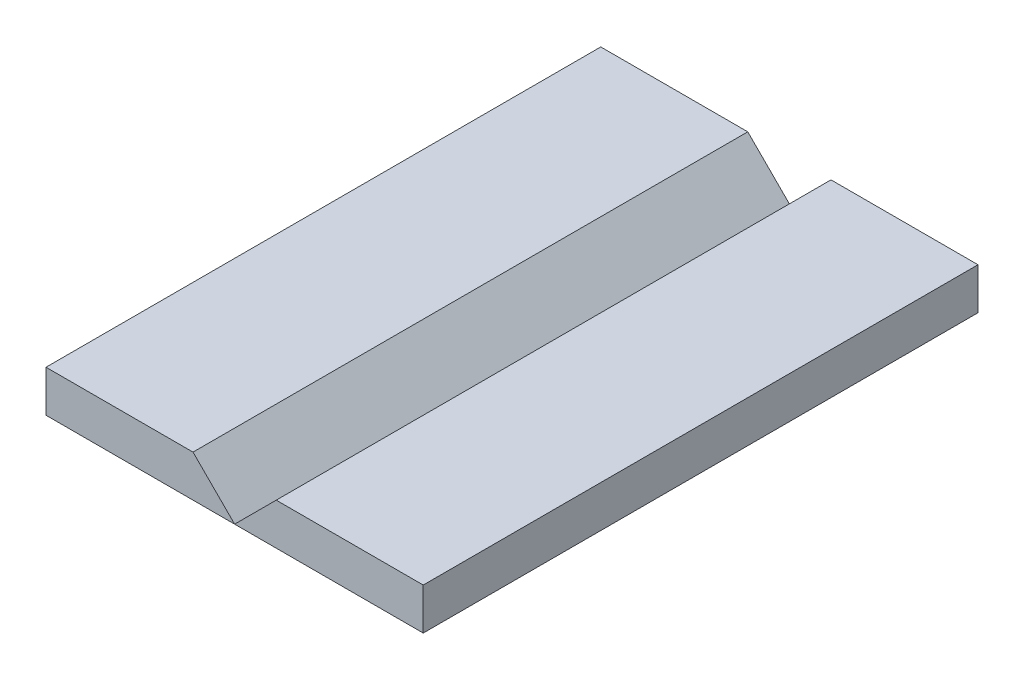
from build123d import *

# Parameters (mm, degrees)
BOSS_EXTRUDE1_DEPTH   = 200
BOSS_EXTRUDE1_2_DEPTH = 200


with BuildPart() as part:
    # Sketch1 → Boss-Extrude1 (new body)
    with BuildSketch(Plane.XY):
        Polygon((0, 15), (0, 0), (68, 0), (53, 15), align=None)
    extrude(amount=BOSS_EXTRUDE1_DEPTH)


with BuildPart() as body_2:
    # Sketch1 → Boss-Extrude1 2 (new body)
    with BuildSketch(Plane.XY):
        Polygon((83, 15), (68, 0), (136, 0), (136, 15), align=None)
    extrude(amount=BOSS_EXTRUDE1_2_DEPTH)


solid = Compound([part.part, body_2.part])
